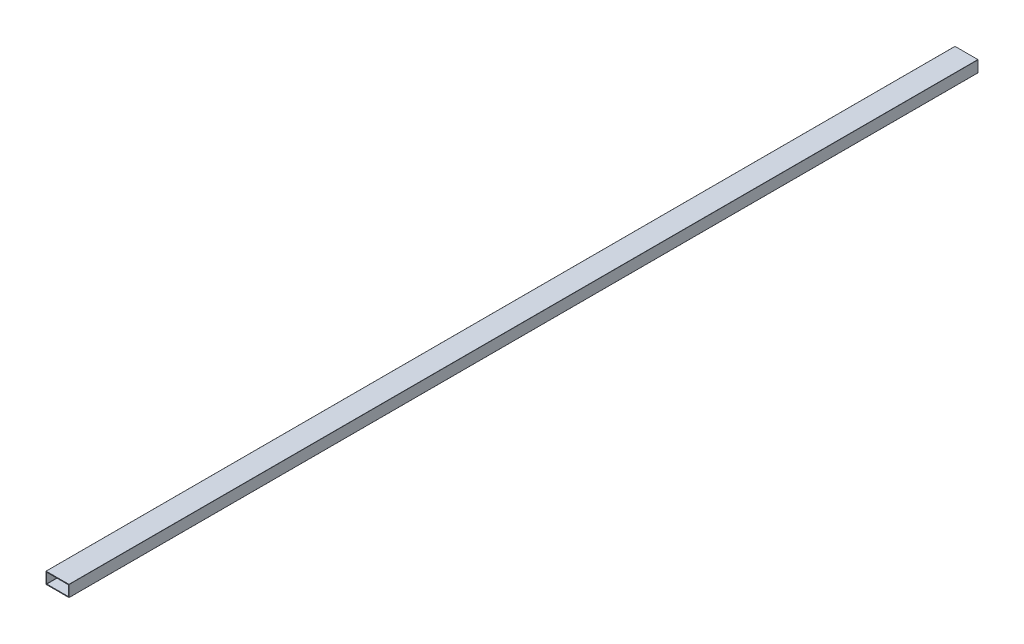
from build123d import *

# Parameters (mm, degrees)
CROQUIS1_W              = 152.4
CROQUIS1_H              = 76.2
CROQUIS1_W_2            = 143.3
CROQUIS1_H_2            = 67.1
SALIENTE_EXTRUIR1_DEPTH = 6000
REDONDEO1_R             = 1


with BuildPart() as part:
    # Croquis1 → Saliente-Extruir1 (new body)
    with BuildSketch(Plane.XY):
        Rectangle(CROQUIS1_W, CROQUIS1_H)
        Rectangle(CROQUIS1_W_2, CROQUIS1_H_2, mode=Mode.SUBTRACT)
    extrude(amount=-SALIENTE_EXTRUIR1_DEPTH)

    # Redondeo1
    redondeo1_edges = [part.edges().sort_by_distance(p)[0] for p in [
        (71.65, -33.55, -3000),
        (-71.65, -33.55, -3000),
        (-71.65, 33.55, -3000),
        (71.65, 33.55, -3000),
        (76.2, -38.1, -3000),
        (-76.2, -38.1, -3000),
        (-76.2, 38.1, -3000),
        (76.2, 38.1, -3000),
    ]]
    fillet(redondeo1_edges, radius=REDONDEO1_R)


solid = part.part
